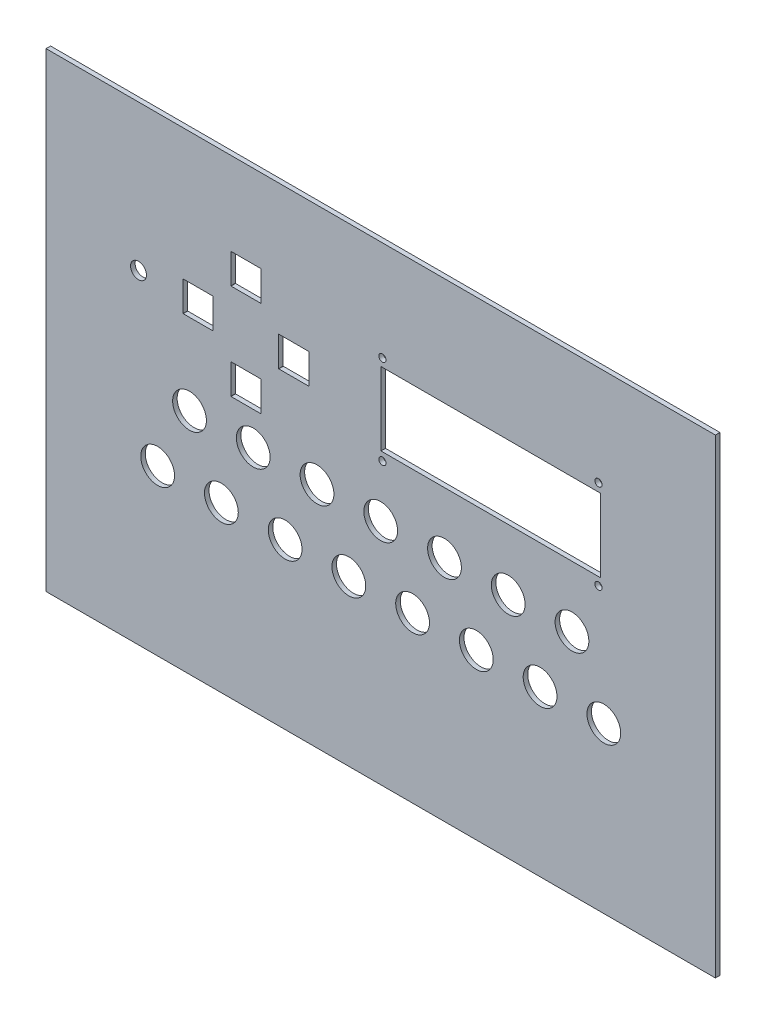
from build123d import *

# Parameters (mm, degrees)
MODEL_W             = 232.41
MODEL_H             = 163.2712
MODEL_R             = 2.766686572
MODEL_R_2           = 5.865375533
BOSS_EXTRUDE2_DEPTH = 1.5748
SKETCH10_W          = 76.2
SKETCH10_H          = 25.4
CUT_EXTRUDE13_DEPTH = 1.5748
SKETCH11_R          = 1.2446
CUT_EXTRUDE14_DEPTH = 279.870205617


with BuildPart() as part:
    # Model → Boss-Extrude2 (new body)
    with BuildSketch(Plane.XY):
        with Locations((80.00320848, 116.527086979)):
            Rectangle(MODEL_W, MODEL_H)
        with Locations((-4.104063311, 147.485885883)):
            Circle(MODEL_R, mode=Mode.SUBTRACT)
        with Locations((68.936462192, 92.041486979)):
            Circle(MODEL_R_2, mode=Mode.SUBTRACT)
        with Locations((2.535984462, 92.041486979)):
            Circle(MODEL_R_2, mode=Mode.SUBTRACT)
        with Locations((24.669477039, 92.041486979)):
            Circle(MODEL_R_2, mode=Mode.SUBTRACT)
        with Locations((46.802969616, 92.041486979)):
            Circle(MODEL_R_2, mode=Mode.SUBTRACT)
        with Locations((91.069954769, 92.041486979)):
            Circle(MODEL_R_2, mode=Mode.SUBTRACT)
        with Locations((113.203447345, 92.041486979)):
            Circle(MODEL_R_2, mode=Mode.SUBTRACT)
        with Locations((135.336939922, 92.041486979)):
            Circle(MODEL_R_2, mode=Mode.SUBTRACT)
        with Locations((157.470432499, 92.041486979)):
            Circle(MODEL_R_2, mode=Mode.SUBTRACT)
        with Locations((146.40368621, 114.174979556)):
            Circle(MODEL_R_2, mode=Mode.SUBTRACT)
        with Locations((124.270193634, 114.174979556)):
            Circle(MODEL_R_2, mode=Mode.SUBTRACT)
        with Locations((102.136701057, 114.174979556)):
            Circle(MODEL_R_2, mode=Mode.SUBTRACT)
        with Locations((80.00320848, 114.174979556)):
            Circle(MODEL_R_2, mode=Mode.SUBTRACT)
        with Locations((57.869715904, 114.174979556)):
            Circle(MODEL_R_2, mode=Mode.SUBTRACT)
        with Locations((35.736223327, 114.174979556)):
            Circle(MODEL_R_2, mode=Mode.SUBTRACT)
        with Locations((13.602730751, 114.174979556)):
            Circle(MODEL_R_2, mode=Mode.SUBTRACT)
        with BuildLine():
            Line((28.016503786, 169.309509564), (38.374978312, 169.309509564))
            ThreePointArc((38.374978312, 169.309509564), (38.406279807, 169.296544074), (38.419245297, 169.265242579))
            Line((38.419245297, 169.265242579), (38.419245297, 158.906768053))
            ThreePointArc((38.419245297, 158.906768053), (38.406279807, 158.875466558), (38.374978312, 158.862501068))
            Line((38.374978312, 158.862501068), (28.016503786, 158.862501068))
            ThreePointArc((28.016503786, 158.862501068), (27.985202291, 158.875466558), (27.972236801, 158.906768053))
            Line((27.972236801, 158.906768053), (27.972236801, 169.265242579))
            ThreePointArc((27.972236801, 169.265242579), (27.985202291, 169.296544074), (28.016503786, 169.309509564))
        make_face(mode=Mode.SUBTRACT)
        with BuildLine():
            Line((28.016503786, 136.109270699), (38.374978312, 136.109270699))
            ThreePointArc((38.374978312, 136.109270699), (38.406279807, 136.096305209), (38.419245297, 136.065003714))
            Line((38.419245297, 136.065003714), (38.419245297, 125.706529188))
            ThreePointArc((38.419245297, 125.706529188), (38.406279807, 125.675227693), (38.374978312, 125.662262203))
            Line((38.374978312, 125.662262203), (28.016503786, 125.662262203))
            ThreePointArc((28.016503786, 125.662262203), (27.985202291, 125.675227693), (27.972236801, 125.706529188))
            Line((27.972236801, 125.706529188), (27.972236801, 136.065003714))
            ThreePointArc((27.972236801, 136.065003714), (27.985202291, 136.096305209), (28.016503786, 136.109270699))
        make_face(mode=Mode.SUBTRACT)
        with BuildLine():
            Line((44.616623219, 152.709390132), (54.975097745, 152.709390132))
            ThreePointArc((54.975097745, 152.709390132), (55.00639924, 152.696424641), (55.01936473, 152.665123146))
            Line((55.01936473, 152.665123146), (55.01936473, 142.306648621))
            ThreePointArc((55.01936473, 142.306648621), (55.00639924, 142.275347125), (54.975097745, 142.262381635))
            Line((54.975097745, 142.262381635), (44.616623219, 142.262381635))
            ThreePointArc((44.616623219, 142.262381635), (44.585321724, 142.275347125), (44.572356234, 142.306648621))
            Line((44.572356234, 142.306648621), (44.572356234, 152.665123146))
            ThreePointArc((44.572356234, 152.665123146), (44.585321724, 152.696424641), (44.616623219, 152.709390132))
        make_face(mode=Mode.SUBTRACT)
        with BuildLine():
            Line((21.819125865, 152.665123146), (21.819125865, 142.306648621))
            ThreePointArc((21.819125865, 142.306648621), (21.806160375, 142.275347125), (21.77485888, 142.262381635))
            Line((21.77485888, 142.262381635), (11.416384354, 142.262381635))
            ThreePointArc((11.416384354, 142.262381635), (11.385082859, 142.275347125), (11.372117369, 142.306648621))
            Line((11.372117369, 142.306648621), (11.372117369, 152.665123146))
            ThreePointArc((11.372117369, 152.665123146), (11.385082859, 152.696424641), (11.416384354, 152.709390132))
            Line((11.416384354, 152.709390132), (21.77485888, 152.709390132))
            ThreePointArc((21.77485888, 152.709390132), (21.806160375, 152.696424641), (21.819125865, 152.665123146))
        make_face(mode=Mode.SUBTRACT)
        with BuildLine():
            Line((146.071683822, 154.070599925), (146.071683822, 141.963579486))
            ThreePointArc((146.071683822, 141.963579486), (146.058718332, 141.93227799), (146.027416836, 141.9193125))
            Line((146.027416836, 141.9193125), (90.339549514, 141.9193125))
            ThreePointArc((90.339549514, 141.9193125), (90.308248019, 141.93227799), (90.295282529, 141.963579486))
            Line((90.295282529, 141.963579486), (90.295282529, 154.070599925))
            ThreePointArc((90.295282529, 154.070599925), (90.308248019, 154.10190142), (90.339549514, 154.11486691))
            Line((90.339549514, 154.11486691), (146.027416836, 154.11486691))
            ThreePointArc((146.027416836, 154.11486691), (146.058718332, 154.10190142), (146.071683822, 154.070599925))
        make_face(mode=Mode.SUBTRACT)
    extrude(amount=BOSS_EXTRUDE2_DEPTH)

    # Sketch10 → Cut-Extrude13 (cut)
    with BuildSketch(Plane.XY.offset(1.5748)):
        with Locations((118.183483175, 148.017089705)):
            Rectangle(SKETCH10_W, SKETCH10_H)
    extrude(amount=-CUT_EXTRUDE13_DEPTH, mode=Mode.SUBTRACT)

    # Sketch11 → Cut-Extrude14 (cut, through all)
    with BuildSketch(Plane(origin=(0, 0, 0), x_dir=(-1, 0, 0), z_dir=(0, 0, -1))):
        with Locations((-155.610383175, 163.523789705)):
            Circle(SKETCH11_R)
        with Locations((-155.610383175, 132.510389705)):
            Circle(SKETCH11_R)
        with Locations((-80.578783175, 132.510389705)):
            Circle(SKETCH11_R)
        with Locations((-80.578783175, 163.523789705)):
            Circle(SKETCH11_R)
    extrude(amount=-CUT_EXTRUDE14_DEPTH, mode=Mode.SUBTRACT)


solid = part.part
